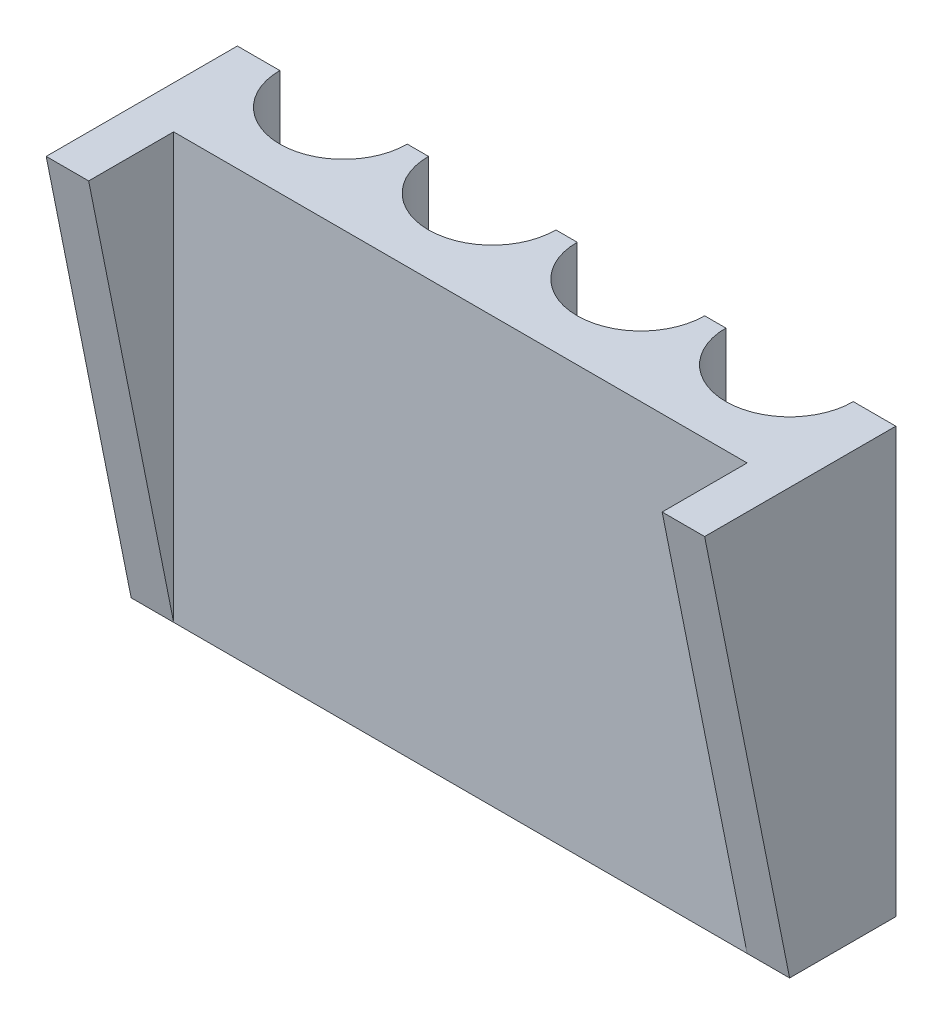
from build123d import *

# Parameters (mm, degrees)
SKETCH1_W               = 155
SKETCH1_H               = 30
BOSS_EXTRUDE1_DEPTH     = 100
SKETCH2_R               = 15
CUT_EXTRUDE2_DEPTH      = 90
SKETCH4_W               = 155
SKETCH4_H               = 100
CUT_EXTRUDE3_DEPTH      = 5
BOSS_EXTRUDE2_DEPTH     = 155
SKETCH6_W               = 135
SKETCH6_H               = 20
CUT_EXTRUDE4_DEPTH      = 145
SKETCH7_W               = 5
SKETCH7_H               = 1
CUT_EXTRUDE6_DEPTH      = 1
CUT_EXTRUDE7_DEPTH      = 6
CUT_EXTRUDE7_DEPTH_BACK = 71
SKETCH8_W               = 1
SKETCH8_H               = 1
SKETCH9_W               = 5
SKETCH9_H               = 1
CUT_EXTRUDE8_DEPTH      = 1
CUT_EXTRUDE9_DEPTH      = 6
CUT_EXTRUDE9_DEPTH_BACK = 71
SKETCH10_W              = 1
SKETCH10_H              = 1


with BuildPart() as part:
    # Sketch1 → Boss-Extrude1 (new body)
    with BuildSketch(Plane(origin=(0, 0, 0), x_dir=(1, 0, 0), z_dir=(0, 1, 0))):
        Rectangle(SKETCH1_W, SKETCH1_H)
    extrude(amount=BOSS_EXTRUDE1_DEPTH)

    # Sketch2 → Cut-Extrude2 (cut)
    with BuildSketch(Plane(origin=(0, 100, 0), x_dir=(1, 0, 0), z_dir=(0, 1, 0))):
        with Locations((-52.5, 15)):
            Circle(SKETCH2_R)
        with Locations((-17.5, 15)):
            Circle(SKETCH2_R)
        with Locations((17.5, 15)):
            Circle(SKETCH2_R)
        with Locations((52.5, 15)):
            Circle(SKETCH2_R)
    extrude(amount=-CUT_EXTRUDE2_DEPTH, mode=Mode.SUBTRACT)

    # Sketch4 → Cut-Extrude3 (cut)
    with BuildSketch(Plane.XY.offset(15)):
        with Locations((0, 50)):
            Rectangle(SKETCH4_W, SKETCH4_H)
    extrude(amount=-CUT_EXTRUDE3_DEPTH, mode=Mode.SUBTRACT)

    # Sketch5 → Boss-Extrude2 (add)
    with BuildSketch(Plane(origin=(77.5, 0, 0), x_dir=(0, 0, -1), z_dir=(1, 0, 0))):
        Polygon((-10, 100), (-30, 100), (-10, 0), align=None)
    extrude(amount=-BOSS_EXTRUDE2_DEPTH)

    # Sketch6 → Cut-Extrude4 (cut)
    with BuildSketch(Plane(origin=(0, 100, 0), x_dir=(1, 0, 0), z_dir=(0, 1, 0))):
        with Locations((0, -20)):
            Rectangle(SKETCH6_W, SKETCH6_H)
    extrude(amount=-CUT_EXTRUDE4_DEPTH, mode=Mode.SUBTRACT)

    # Sketch7 → Cut-Extrude6 (cut)
    with BuildSketch(Plane(origin=(0, 0, -15), x_dir=(-1, 0, 0), z_dir=(0, 0, -1))):
        with Locations((-35, 13.5)):
            Rectangle(SKETCH7_W, SKETCH7_H)
    extrude(amount=-CUT_EXTRUDE6_DEPTH, mode=Mode.SUBTRACT)

    # Sketch8 → Cut-Extrude7 (cut, two sides: drawn at the far end of the back side and taken through both)
    with BuildSketch(Plane(origin=(32.5, 0, 0), x_dir=(0, 0, -1), z_dir=(1, 0, 0)).offset(-CUT_EXTRUDE7_DEPTH_BACK)):
        with Locations((14.5, 13.5)):
            Rectangle(SKETCH8_W, SKETCH8_H)
    extrude(amount=CUT_EXTRUDE7_DEPTH + CUT_EXTRUDE7_DEPTH_BACK, mode=Mode.SUBTRACT)

    # Sketch9 → Cut-Extrude8 (cut)
    with BuildSketch(Plane(origin=(0, 0, -15), x_dir=(-1, 0, 0), z_dir=(0, 0, -1))):
        with Locations((-35, 17.5)):
            Rectangle(SKETCH9_W, SKETCH9_H)
    extrude(amount=-CUT_EXTRUDE8_DEPTH, mode=Mode.SUBTRACT)

    # Sketch10 → Cut-Extrude9 (cut, two sides: drawn at the far end of the back side and taken through both)
    with BuildSketch(Plane(origin=(32.5, 0, 0), x_dir=(0, 0, -1), z_dir=(1, 0, 0)).offset(-CUT_EXTRUDE9_DEPTH_BACK)):
        with Locations((14.5, 17.5)):
            Rectangle(SKETCH10_W, SKETCH10_H)
    extrude(amount=CUT_EXTRUDE9_DEPTH + CUT_EXTRUDE9_DEPTH_BACK, mode=Mode.SUBTRACT)


solid = part.part
